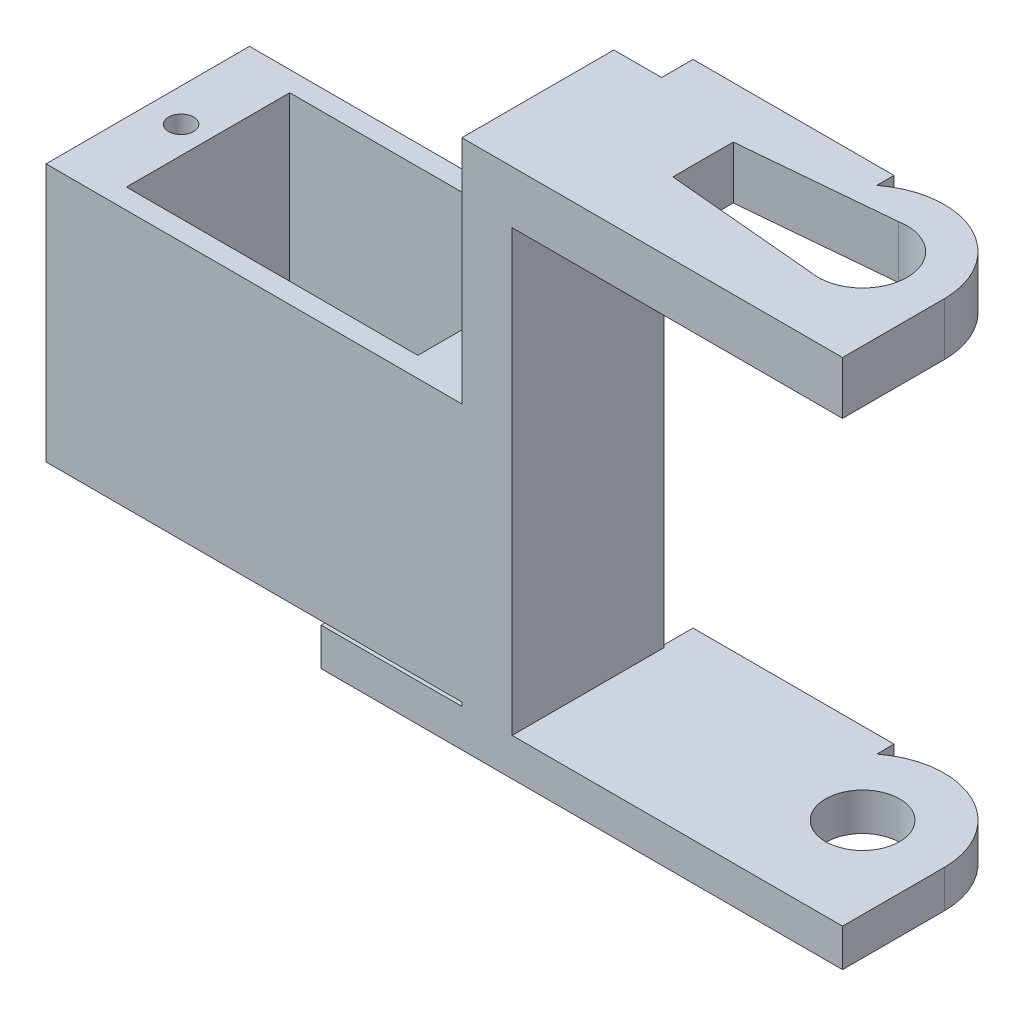
from build123d import *

# Parameters (mm, degrees)
BOSS_EXTRUDE1_START  = 17.075
SKETCH1_W            = 32.8
SKETCH1_H            = 16.2
BOSS_EXTRUDE1_DEPTH  = 10.275
BOSS_EXTRUDE2_START  = 5
SKETCH2_W            = 31
SKETCH2_H            = 12.1
BOSS_EXTRUDE2_DEPTH  = 1.5
BOSS_EXTRUDE3_START  = 5
SKETCH3_W            = 16
SKETCH3_H            = 14.6
BOSS_EXTRUDE3_DEPTH  = 1.5
BOSS_EXTRUDE4_START  = 5
SKETCH4_W            = 10.5
SKETCH4_H            = 8.1
BOSS_EXTRUDE4_DEPTH  = 1.5
BOSS_EXTRUDE5_START  = 5
SKETCH5_R            = 6.5
BOSS_EXTRUDE5_DEPTH  = 1.5
CUT_EXTRUDE1_START   = 5
SKETCH6_R            = 2.95
CUT_EXTRUDE1_DEPTH   = 1.5
BOSS_EXTRUDE6_START  = 70.2
SKETCH7_W            = 12.1
SKETCH7_H            = 42.2
BOSS_EXTRUDE6_DEPTH  = 2
BOSS_EXTRUDE7_START  = 68.05
SKETCH8_W            = 12.1
SKETCH8_H            = 20.55
BOSS_EXTRUDE7_DEPTH  = 1.15
BOSS_EXTRUDE8_START  = 43.6
SKETCH9_W            = 19.8
SKETCH9_H            = 12.1
BOSS_EXTRUDE8_DEPTH  = 2.1
BOSS_EXTRUDE9_START  = 43.6
SKETCH10_W           = 16
SKETCH10_H           = 14.6
BOSS_EXTRUDE9_DEPTH  = 2.1
BOSS_EXTRUDE10_START = 43.6
SKETCH11_W           = 10.5
SKETCH11_H           = 8.1
BOSS_EXTRUDE10_DEPTH = 2.1
BOSS_EXTRUDE11_START = 43.6
SKETCH12_R           = 6.5
BOSS_EXTRUDE11_DEPTH = 2.1
CUT_EXTRUDE2_START   = 43.6
SKETCH13_R           = 3.55
CUT_EXTRUDE2_DEPTH   = 2.1
CUT_EXTRUDE3_START   = 43.6
CUT_EXTRUDE3_DEPTH   = 2.1
CUT_EXTRUDE4_START   = 18.725
SKETCH15_W           = 23.2
SKETCH15_H           = 13
CUT_EXTRUDE4_DEPTH   = 8.625
CUT_EXTRUDE5_START   = 24.35
SKETCH16_R           = 1
CUT_EXTRUDE5_DEPTH   = 3
CUT_EXTRUDE6_START   = 24.35
SKETCH17_R           = 1
CUT_EXTRUDE6_DEPTH   = 3
CUT_EXTRUDE7_START   = 8.1
SKETCH18_R           = 3.15
CUT_EXTRUDE7_DEPTH   = 1.3
CUT_EXTRUDE8_START   = 37.5
SKETCH19_W           = 4.4
SKETCH19_H           = 6
CUT_EXTRUDE8_DEPTH   = 2.4


with BuildPart() as part:
    # Sketch1 → Boss-Extrude1 (new, symmetric)
    with BuildSketch(Plane(origin=(0, 0, 0), x_dir=(1, 0, 0), z_dir=(0, 1, 0)).offset(BOSS_EXTRUDE1_START)):
        with Locations((51.5, 0)):
            Rectangle(SKETCH1_W, SKETCH1_H)
    extrude(amount=BOSS_EXTRUDE1_DEPTH, both=True)



with BuildPart() as body_2:
    # Sketch2 → Boss-Extrude2 (new, symmetric)
    with BuildSketch(Plane(origin=(0, 0, 0), x_dir=(1, 0, 0), z_dir=(0, 1, 0)).offset(BOSS_EXTRUDE2_START)):
        with Locations((72.5, -2.05)):
            Rectangle(SKETCH2_W, SKETCH2_H)
    extrude(amount=BOSS_EXTRUDE2_DEPTH, both=True)

    # Sketch3 → Boss-Extrude3 (add, symmetric)
    with BuildSketch(Plane(origin=(0, 0, 0), x_dir=(1, 0, 0), z_dir=(0, 1, 0)).offset(BOSS_EXTRUDE3_START)):
        with Locations((80, -0.8)):
            Rectangle(SKETCH3_W, SKETCH3_H)
    extrude(amount=BOSS_EXTRUDE3_DEPTH, both=True)

    # Sketch4 → Boss-Extrude4 (add, symmetric)
    with BuildSketch(Plane(origin=(0, 0, 0), x_dir=(1, 0, 0), z_dir=(0, 1, 0)).offset(BOSS_EXTRUDE4_START)):
        with Locations((93.25, -4.05)):
            Rectangle(SKETCH4_W, SKETCH4_H)
    extrude(amount=BOSS_EXTRUDE4_DEPTH, both=True)

    # Sketch5 → Boss-Extrude5 (add, symmetric)
    with BuildSketch(Plane(origin=(0, 0, 0), x_dir=(1, 0, 0), z_dir=(0, 1, 0)).offset(BOSS_EXTRUDE5_START)):
        with Locations((92, 0)):
            Circle(SKETCH5_R)
    extrude(amount=BOSS_EXTRUDE5_DEPTH, both=True)

    # Sketch6 → Cut-Extrude1 (cut, symmetric)
    with BuildSketch(Plane(origin=(0, 0, 0), x_dir=(1, 0, 0), z_dir=(0, 1, 0)).offset(CUT_EXTRUDE1_START)):
        with Locations(Location((92, 0, 0), (0, 0, 270))):
            Circle(SKETCH6_R)
    extrude(amount=CUT_EXTRUDE1_DEPTH, both=True, mode=Mode.SUBTRACT)

    # Sketch7 → Boss-Extrude6 (add, symmetric)
    with BuildSketch(Plane(origin=(0, 0, 0), x_dir=(0, 0, -1), z_dir=(1, 0, 0)).offset(BOSS_EXTRUDE6_START)):
        with Locations((-2.05, 24.6)):
            Rectangle(SKETCH7_W, SKETCH7_H)
    extrude(amount=BOSS_EXTRUDE6_DEPTH, both=True)


with BuildPart() as part_1:
    add(part.part)

    add(body_2.part)  # Boss-Extrude7 merges body 2
    # Sketch8 → Boss-Extrude7 (add, symmetric)
    with BuildSketch(Plane(origin=(0, 0, 0), x_dir=(0, 0, -1), z_dir=(1, 0, 0)).offset(BOSS_EXTRUDE7_START)):
        with Locations((-2.05, 17.075)):
            Rectangle(SKETCH8_W, SKETCH8_H)
    extrude(amount=BOSS_EXTRUDE7_DEPTH, both=True)

    # Sketch9 → Boss-Extrude8 (add, symmetric)
    with BuildSketch(Plane(origin=(0, 0, 0), x_dir=(1, 0, 0), z_dir=(0, 1, 0)).offset(BOSS_EXTRUDE8_START)):
        with Locations((78.1, -2.05)):
            Rectangle(SKETCH9_W, SKETCH9_H)
    extrude(amount=BOSS_EXTRUDE8_DEPTH, both=True)

    # Sketch10 → Boss-Extrude9 (add, symmetric)
    with BuildSketch(Plane(origin=(0, 0, 0), x_dir=(1, 0, 0), z_dir=(0, 1, 0)).offset(BOSS_EXTRUDE9_START)):
        with Locations((80, -0.8)):
            Rectangle(SKETCH10_W, SKETCH10_H)
    extrude(amount=BOSS_EXTRUDE9_DEPTH, both=True)

    # Sketch11 → Boss-Extrude10 (add, symmetric)
    with BuildSketch(Plane(origin=(0, 0, 0), x_dir=(1, 0, 0), z_dir=(0, 1, 0)).offset(BOSS_EXTRUDE10_START)):
        with Locations((93.25, -4.05)):
            Rectangle(SKETCH11_W, SKETCH11_H)
    extrude(amount=BOSS_EXTRUDE10_DEPTH, both=True)

    # Sketch12 → Boss-Extrude11 (add, symmetric)
    with BuildSketch(Plane(origin=(0, 0, 0), x_dir=(1, 0, 0), z_dir=(0, 1, 0)).offset(BOSS_EXTRUDE11_START)):
        with Locations((92, 0)):
            Circle(SKETCH12_R)
    extrude(amount=BOSS_EXTRUDE11_DEPTH, both=True)

    # Sketch13 → Cut-Extrude2 (cut, symmetric)
    with BuildSketch(Plane(origin=(0, 0, 0), x_dir=(1, 0, 0), z_dir=(0, 1, 0)).offset(CUT_EXTRUDE2_START)):
        with Locations(Location((92, 0, 0), (0, 0, 270))):
            Circle(SKETCH13_R)
    extrude(amount=CUT_EXTRUDE2_DEPTH, both=True, mode=Mode.SUBTRACT)

    # Sketch14 → Cut-Extrude3 (cut, symmetric)
    with BuildSketch(Plane(origin=(0, 0, 0), x_dir=(1, 0, 0), z_dir=(0, 1, 0)).offset(CUT_EXTRUDE3_START)):
        Polygon((92, 3.55), (79.3, 2.403281405), (79.3, -2.403281405), (92, -3.55), align=None)
    extrude(amount=CUT_EXTRUDE3_DEPTH, both=True, mode=Mode.SUBTRACT)

    # Sketch15 → Cut-Extrude4 (cut, symmetric)
    with BuildSketch(Plane(origin=(0, 0, 0), x_dir=(1, 0, 0), z_dir=(0, 1, 0)).offset(CUT_EXTRUDE4_START)):
        with Locations((51.5, 0)):
            Rectangle(SKETCH15_W, SKETCH15_H)
    extrude(amount=CUT_EXTRUDE4_DEPTH, both=True, mode=Mode.SUBTRACT)

    # Sketch16 → Cut-Extrude5 (cut, symmetric)
    with BuildSketch(Plane(origin=(0, 0, 0), x_dir=(1, 0, 0), z_dir=(0, 1, 0)).offset(CUT_EXTRUDE5_START)):
        with Locations(Location((65.25, 0, 0), (0, 0, 270))):
            Circle(SKETCH16_R)
    extrude(amount=CUT_EXTRUDE5_DEPTH, both=True, mode=Mode.SUBTRACT)

    # Sketch17 → Cut-Extrude6 (cut, symmetric)
    with BuildSketch(Plane(origin=(0, 0, 0), x_dir=(1, 0, 0), z_dir=(0, 1, 0)).offset(CUT_EXTRUDE6_START)):
        with Locations(Location((37.75, 0, 0), (0, 0, 270))):
            Circle(SKETCH17_R)
    extrude(amount=CUT_EXTRUDE6_DEPTH, both=True, mode=Mode.SUBTRACT)

    # Sketch18 → Cut-Extrude7 (cut, symmetric)
    with BuildSketch(Plane(origin=(0, 0, 0), x_dir=(1, 0, 0), z_dir=(0, 1, 0)).offset(CUT_EXTRUDE7_START)):
        with Locations(Location((46, 0, 0), (0, 0, 270))):
            Circle(SKETCH18_R)
    extrude(amount=CUT_EXTRUDE7_DEPTH, both=True, mode=Mode.SUBTRACT)

    # Sketch19 → Cut-Extrude8 (cut, symmetric)
    with BuildSketch(Plane(origin=(0, 0, 0), x_dir=(0, 0, -1), z_dir=(1, 0, 0)).offset(CUT_EXTRUDE8_START)):
        with Locations((0, 13.1)):
            Rectangle(SKETCH19_W, SKETCH19_H)
    extrude(amount=CUT_EXTRUDE8_DEPTH, both=True, mode=Mode.SUBTRACT)


solid = part_1.part
